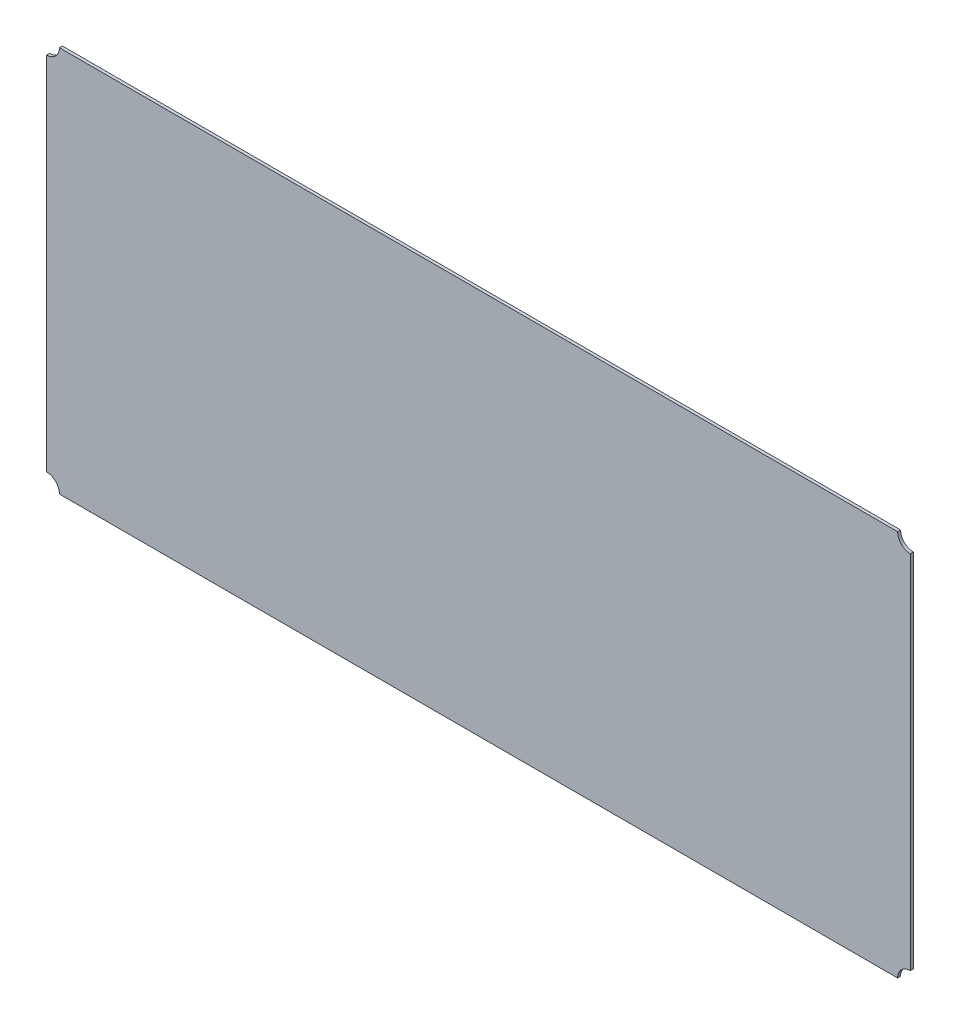
from build123d import *

# Parameters (mm, degrees)
SKETCH1_W               = 882.5
SKETCH1_H               = 395
BOSS_EXTRUDE1_DEPTH     = 3
CUT_EXTRUDE1_DEPTH      = 484.442667232
CUT_EXTRUDE1_DEPTH_BACK = 484.442667232
SKETCH3_R               = 13


with BuildPart() as part:
    # Sketch1 → Boss-Extrude1 (new body)
    with BuildSketch(Plane.XY):
        Rectangle(SKETCH1_W, SKETCH1_H)
    extrude(amount=-BOSS_EXTRUDE1_DEPTH)

    # Sketch3 → Cut-Extrude1 (cut, two sides: drawn at the far end of the back side and taken through both)
    with BuildSketch(Plane.XY.offset(-CUT_EXTRUDE1_DEPTH_BACK)):
        with Locations((441.25, -197.5)):
            Circle(SKETCH3_R)
        with Locations((441.25, 197.5)):
            Circle(SKETCH3_R)
        with Locations((-441.25, 197.5)):
            Circle(SKETCH3_R)
        with Locations((-441.25, -197.5)):
            Circle(SKETCH3_R)
    extrude(amount=CUT_EXTRUDE1_DEPTH + CUT_EXTRUDE1_DEPTH_BACK, mode=Mode.SUBTRACT)


solid = part.part
